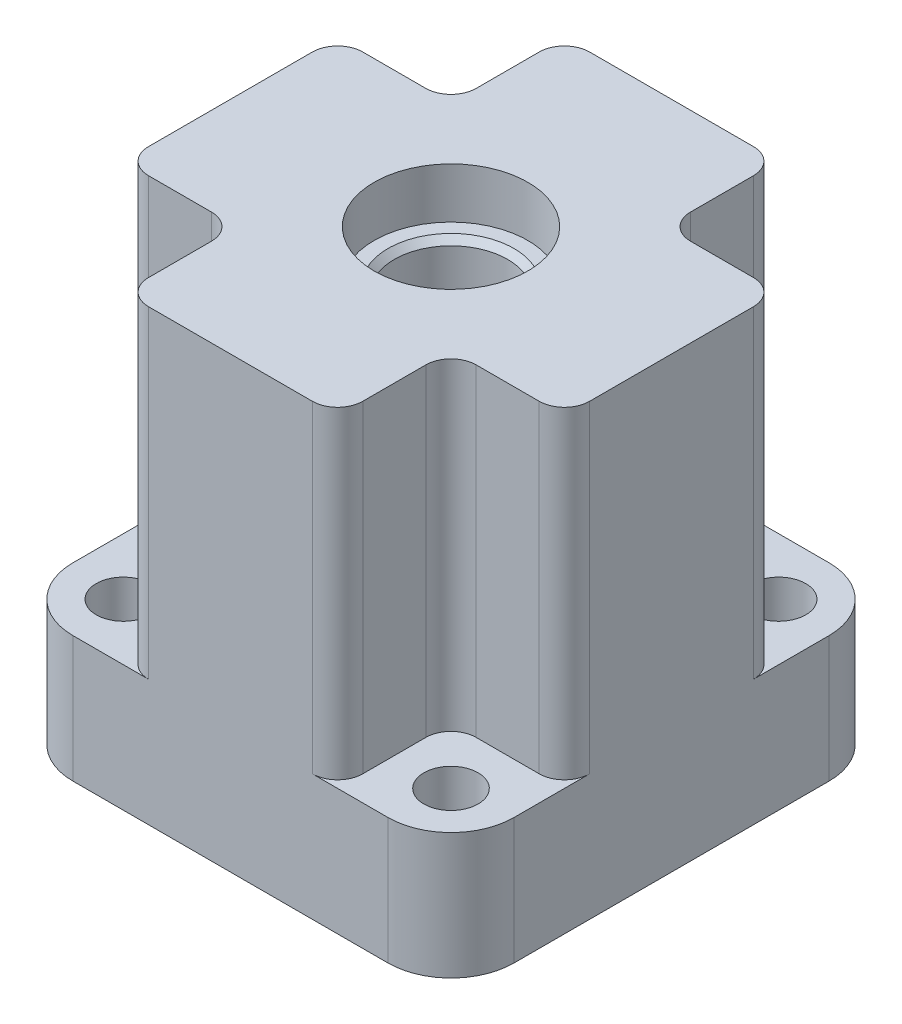
from build123d import *
from build123d.topology import SkipClean

# Parameters (mm, degrees)
SKETCH_1_W          = 35
SKETCH_1_H          = 35
SKETCH_1_R          = 4.5
SKETCH_1_R_2        = 2.15
EXTRUDE_1_DEPTH     = 25
FILLET_1_R          = 5
SKETCH_3_R          = 6.1
CUT_EXTRUDE_1_DEPTH = 4
SKETCH_4_R          = 6.1
CUT_EXTRUDE_2_DEPTH = 4
SKETCH_6_R          = 10
CUT_EXTRUDE_3_DEPTH = 9
EXTRUDE_START       = 10.6
SKETCH_7_R          = 2.15
SKETCH_7_R_2        = 10
EXTRUDE_2_DEPTH     = 10.6
SKETCH_8_W          = 9
SKETCH_8_H          = 9
CUT_EXTRUDE_4_DEPTH = 25.6
FILLET_2_R          = 2
CHAMFER_1_SIZE      = 1
CHAMFER_2_SIZE      = 0.5


with BuildPart() as part:
    # 草图1 → 凸台-拉伸1 (new body)
    with BuildSketch(Plane(origin=(0, 0, 0), x_dir=(1, 0, 0), z_dir=(0, 1, 0))):
        Rectangle(SKETCH_1_W, SKETCH_1_H)
        with Locations(Location((0, 0, 0), (0, 0, 270))):
            Circle(SKETCH_1_R, mode=Mode.SUBTRACT)
        with Locations(Location((13, 13, 0), (0, 0, 270))):
            Circle(SKETCH_1_R_2, mode=Mode.SUBTRACT)
        with Locations(Location((13, -13, 0), (0, 0, 270))):
            Circle(SKETCH_1_R_2, mode=Mode.SUBTRACT)
        with Locations(Location((-13, -13, 0), (0, 0, 270))):
            Circle(SKETCH_1_R_2, mode=Mode.SUBTRACT)
        with Locations(Location((-13, 13, 0), (0, 0, 270))):
            Circle(SKETCH_1_R_2, mode=Mode.SUBTRACT)
    extrude(amount=EXTRUDE_1_DEPTH)

    # 圆角1
    fillet_1_edges = [part.edges().sort_by_distance(p)[0] for p in [
        (17.5, 12.5, 17.5),
        (-17.5, 12.5, 17.5),
        (-17.5, 12.5, -17.5),
        (17.5, 12.5, -17.5),
    ]]
    fillet(fillet_1_edges, radius=FILLET_1_R)

    # 草图3 → 切除-拉伸1 (cut)
    with BuildSketch(Plane(origin=(0, 25, 0), x_dir=(1, 0, 0), z_dir=(0, 1, 0))):
        with Locations(Location((0, 0, 0), (0, 0, 270))):
            Circle(SKETCH_3_R)
    extrude(amount=-CUT_EXTRUDE_1_DEPTH, mode=Mode.SUBTRACT)

    # 草图4 → 切除-拉伸2 (cut)
    with BuildSketch(Plane(origin=(0, 13, 0), x_dir=(1, 0, 0), z_dir=(0, 1, 0))):
        with Locations(Location((0, 0, 0), (0, 0, 270))):
            Circle(SKETCH_4_R)
    extrude(amount=-CUT_EXTRUDE_2_DEPTH, mode=Mode.SUBTRACT)

    # 草图6 → 切除-拉伸3 (cut)
    with BuildSketch(Plane.XZ):
        with Locations(Location((0, 0, 0), (0, 0, 270))):
            Circle(SKETCH_6_R)
    extrude(amount=-CUT_EXTRUDE_3_DEPTH, mode=Mode.SUBTRACT)

    # 草图7 → 凸台-拉伸2 (add)
    with SkipClean():  # the faces are left unmerged after this step: merging them gives an invalid solid
        with BuildSketch(Plane.XZ.offset(EXTRUDE_START)):
            with BuildLine():
                Line((-12.5, -17.5), (12.5, -17.5))
                ThreePointArc((12.5, -17.5), (16.035533906, -16.035533906), (17.5, -12.5))
                Line((17.5, -12.5), (17.5, 12.5))
                ThreePointArc((17.5, 12.5), (16.035533906, 16.035533906), (12.5, 17.5))
                Line((12.5, 17.5), (-12.5, 17.5))
                ThreePointArc((-12.5, 17.5), (-16.035533906, 16.035533906), (-17.5, 12.5))
                Line((-17.5, 12.5), (-17.5, -12.5))
                ThreePointArc((-17.5, -12.5), (-16.035533906, -16.035533906), (-12.5, -17.5))
            make_face()
            with Locations(Location((-13, -13, 0), (0, 0, 270))):
                Circle(SKETCH_7_R, mode=Mode.SUBTRACT)
            with Locations(Location((-13, 13, 0), (0, 0, 270))):
                Circle(SKETCH_7_R, mode=Mode.SUBTRACT)
            with Locations(Location((0, 0, 0), (0, 0, 270))):
                Circle(SKETCH_7_R_2, mode=Mode.SUBTRACT)
            with Locations(Location((13, -13, 0), (0, 0, 270))):
                Circle(SKETCH_7_R, mode=Mode.SUBTRACT)
            with Locations(Location((13, 13, 0), (0, 0, 270))):
                Circle(SKETCH_7_R, mode=Mode.SUBTRACT)
        extrude(amount=-EXTRUDE_2_DEPTH)

    # 草图8 → 切除-拉伸4 (cut)
    with BuildSketch(Plane(origin=(0, 25, 0), x_dir=(1, 0, 0), z_dir=(0, 1, 0))):
        with Locations((-13, 13)):
            Rectangle(SKETCH_8_W, SKETCH_8_H)
        with Locations((13, 13)):
            Rectangle(SKETCH_8_W, SKETCH_8_H)
        with Locations((13, -13)):
            Rectangle(SKETCH_8_W, SKETCH_8_H)
        with Locations((-13, -13)):
            Rectangle(SKETCH_8_W, SKETCH_8_H)
    extrude(amount=-CUT_EXTRUDE_4_DEPTH, mode=Mode.SUBTRACT)

    # 圆角2
    fillet_2_edges = [part.edges().sort_by_distance(p)[0] for p in [
        (-17.5, 12.2, 8.5),
        (-8.5, 12.2, 8.5),
        (-8.5, 12.2, 17.5),
        (8.5, 12.2, 17.5),
        (8.5, 12.2, 8.5),
        (17.5, 12.2, 8.5),
        (17.5, 12.2, -8.5),
        (8.5, 12.2, -8.5),
        (8.5, 12.2, -17.5),
        (-17.5, 12.2, -8.5),
        (-8.5, 12.2, -17.5),
        (-8.5, 12.2, -8.5),
    ]]
    fillet(fillet_2_edges, radius=FILLET_2_R)

    # 倒角1
    chamfer_1_edges = [part.edges().sort_by_distance(p)[0] for p in [
        (0, -10.6, 10),
    ]]
    chamfer(chamfer_1_edges, length=CHAMFER_1_SIZE)

    # 倒角2
    chamfer_2_edges = [part.edges().sort_by_distance(p)[0] for p in [
        (0, 21, -4.5),
        (0, 13, -4.5),
    ]]
    chamfer(chamfer_2_edges, length=CHAMFER_2_SIZE)


solid = part.part
